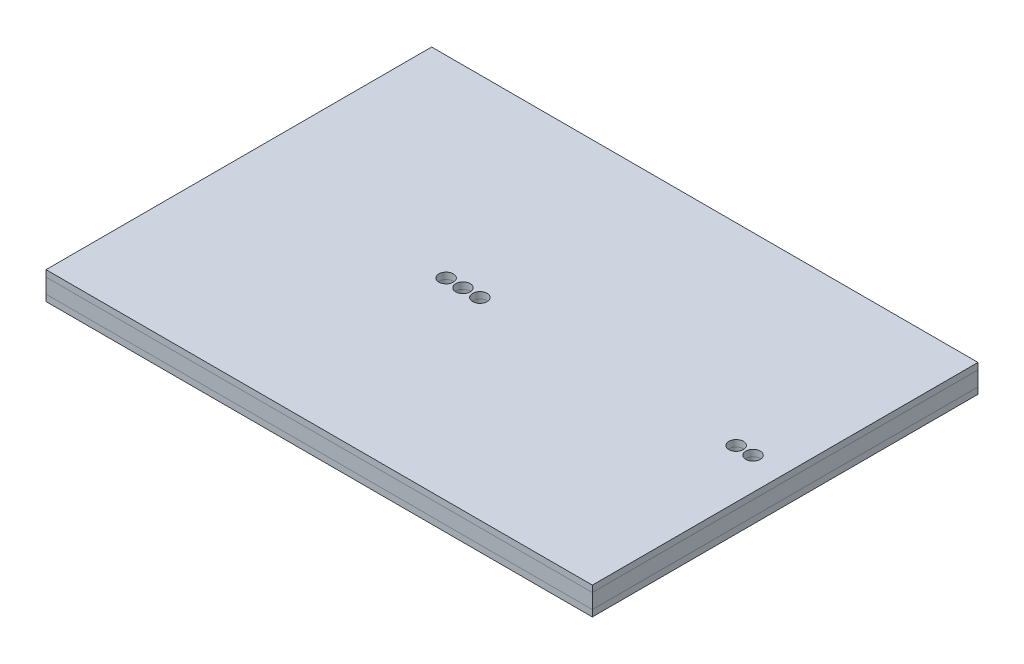
from build123d import *
from build123d.topology import SkipClean

# Parameters (mm, degrees)
SKETCH1_W           = 170
SKETCH1_H           = 60
BOSS_EXTRUDE1_DEPTH = 2
SKETCH2_W           = 170
SKETCH2_H           = 60
BOSS_EXTRUDE2_DEPTH = 4.6
SKETCH3_W           = 170
SKETCH3_H           = 60
BOSS_EXTRUDE3_DEPTH = 2
SKETCH4_R           = 2.25
CUT_EXTRUDE1_DEPTH  = 105.398084274
SKETCH8_W           = 2.25
SKETCH8_H           = 8.6


with BuildPart() as part:
    # Sketch1 → Boss-Extrude1 (new body)
    with BuildSketch(Plane(origin=(0, 0, 0), x_dir=(1, 0, 0), z_dir=(0, 1, 0))):
        with Locations((0, 30)):
            Rectangle(SKETCH1_W, SKETCH1_H)
    extrude(amount=BOSS_EXTRUDE1_DEPTH)


with BuildPart() as body_2:
    # Sketch2 → Boss-Extrude2 (new body)
    with BuildSketch(Plane.XZ):
        with Locations((0, -30)):
            Rectangle(SKETCH2_W, SKETCH2_H)
    extrude(amount=BOSS_EXTRUDE2_DEPTH)


with BuildPart() as body_3:
    # Sketch3 → Boss-Extrude3 (new body)
    with BuildSketch(Plane.XZ.offset(4.6)):
        with Locations((0, -30)):
            Rectangle(SKETCH3_W, SKETCH3_H)
    extrude(amount=BOSS_EXTRUDE3_DEPTH)


with BuildPart() as cut_extrude1_tool:
    # Sketch4 → Cut-Extrude1 (new, through all)
    with BuildSketch(Plane(origin=(0, 2, 0), x_dir=(1, 0, 0), z_dir=(0, 1, 0))):
        with Locations((75, 0)):
            Circle(SKETCH4_R)
        with Locations((-10, 0)):
            Circle(SKETCH4_R)
        with Locations((69.75, 0)):
            Circle(SKETCH4_R)
        with Locations((-15.25, 0)):
            Circle(SKETCH4_R)
    extrude(amount=-CUT_EXTRUDE1_DEPTH)


with BuildPart() as part_1:
    add(part.part)

    # Cut-Extrude1: cut by cut_extrude1_tool
    add(cut_extrude1_tool.part, mode=Mode.SUBTRACT)


with BuildPart() as body_2_1:
    add(body_2.part)

    # Cut-Extrude1: cut by cut_extrude1_tool
    add(cut_extrude1_tool.part, mode=Mode.SUBTRACT)


with BuildPart() as body_3_1:
    add(body_3.part)

    # Cut-Extrude1: cut by cut_extrude1_tool
    add(cut_extrude1_tool.part, mode=Mode.SUBTRACT)


with BuildPart() as f_4_5_4_5_diameter_hole1_tool:
    # Sketch8 → Ø4.5 (4.5) Diameter Hole1 (revolve)
    with BuildSketch(Plane(origin=(-20.5, 2, 0), x_dir=(0, 0, 1), z_dir=(1, 0, 0))):
        with Locations((1.125, 4.3)):
            Rectangle(SKETCH8_W, SKETCH8_H)
    revolve(axis=Axis((-20.5, 8.35, 0), (0, -1, 0)))


with BuildPart() as part_2:
    add(part_1.part)

    # Ø4.5 (4.5) Diameter Hole1: cut by f_4_5_4_5_diameter_hole1_tool
    add(f_4_5_4_5_diameter_hole1_tool.part, mode=Mode.SUBTRACT)

    # Mirror1: part across plane


with BuildPart() as body_2_2:
    add(body_2_1.part)

    # Ø4.5 (4.5) Diameter Hole1: cut by f_4_5_4_5_diameter_hole1_tool
    add(f_4_5_4_5_diameter_hole1_tool.part, mode=Mode.SUBTRACT)

    # Mirror1 2: body 2 across plane


with BuildPart() as body_3_2:
    add(body_3_1.part)

    # Ø4.5 (4.5) Diameter Hole1: cut by f_4_5_4_5_diameter_hole1_tool
    add(f_4_5_4_5_diameter_hole1_tool.part, mode=Mode.SUBTRACT)

    # Mirror1 3: body 3 across plane


with BuildPart() as part_3:
    with SkipClean():  # the faces are left unmerged after this step: merging them gives an invalid solid
        add(part_2.part)
        add(part_2.part.mirror(Plane(origin=(85, -4.6, 0), x_dir=(1, 0, 0), z_dir=(0, 0, -1))))


with BuildPart() as body_2_3:
    with SkipClean():  # the faces are left unmerged after this step: merging them gives an invalid solid
        add(body_2_2.part)
        add(body_2_2.part.mirror(Plane(origin=(85, -4.6, 0), x_dir=(1, 0, 0), z_dir=(0, 0, -1))))


with BuildPart() as body_3_3:
    with SkipClean():  # the faces are left unmerged after this step: merging them gives an invalid solid
        add(body_3_2.part)
        add(body_3_2.part.mirror(Plane(origin=(85, -4.6, 0), x_dir=(1, 0, 0), z_dir=(0, 0, -1))))


solid = Compound([part_3.part, body_2_3.part, body_3_3.part])
